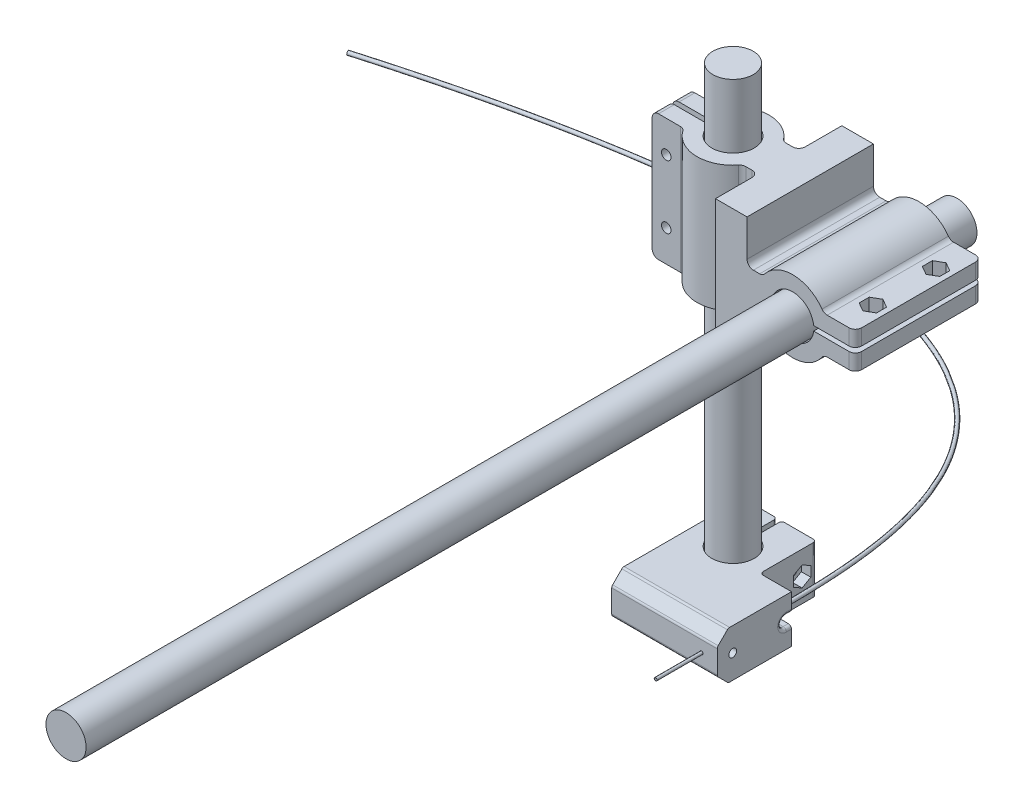
from build123d import *

# Parameters (mm, degrees)
BOSS_EXTRUDE1_DEPTH       = 40
BOSS_EXTRUDE1_DEPTH_BACK  = 100
SKETCH1_R                 = 6.4
BOSS_EXTRUDE2_DEPTH       = 20
BOSS_EXTRUDE2_DEPTH_BACK  = 20
SKETCH6_W                 = 40
SKETCH6_H                 = 40
BOSS_EXTRUDE6_DEPTH       = 10
BOSS_EXTRUDE7_DEPTH       = 20
BOSS_EXTRUDE7_DEPTH_BACK  = 20
FILLET4_R                 = 2
FILLET5_R                 = 2
CUT_EXTRUDE1_REACH        = 120.786
SKETCH9_R                 = 1.5
SKETCH37_R                = 1.25
CUT_EXTRUDE24_DEPTH       = 5
CUT_EXTRUDE2_REACH        = 114.828
SKETCH10_R                = 2.5
SKETCH38_R                = 1.25
CUT_EXTRUDE25_DEPTH       = 5
FILLET12_R                = 2
BOSS_EXTRUDE8_DEPTH       = 7.5
BOSS_EXTRUDE8_DEPTH_BACK  = 7.5
FILLET6_R                 = 1
FILLET7_R                 = 1
CUT_EXTRUDE8_REACH        = 133.251
SKETCH17_R                = 1.55
CUT_EXTRUDE9_DEPTH        = 3
SKETCH19_R                = 6.4
BOSS_EXTRUDE9_DEPTH       = 20
BOSS_EXTRUDE11_DEPTH      = 10
CUT_EXTRUDE15_DEPTH       = 23.4
SKETCH29_R                = 0.5
CUT_EXTRUDE16_DEPTH       = 23.5
SKETCH30_R                = 1.75
CUT_EXTRUDE17_DEPTH       = 8
FILLET10_R                = 1
SKETCH31_R                = 1.25
CUT_EXTRUDE18_DEPTH       = 5
CUT_EXTRUDE19_DEPTH       = 5
FILLET11_R                = 1
BOSS_EXTRUDE12_DEPTH      = 250
BOSS_EXTRUDE12_DEPTH_BACK = 32
SKETCH39_R                = 6.35
BOSS_EXTRUDE13_DEPTH      = 10
BOSS_EXTRUDE13_DEPTH_BACK = 30
SKETCH41_R                = 0.45
SKETCH41_R_2              = 0.4
SKETCH43_R                = 0.6


with BuildPart() as part:
    # Sketch1 → Boss-Extrude1 (new, two sides: drawn at the far end of the back side and taken through both)
    with BuildSketch(Plane(origin=(0, 0, 0), x_dir=(1, 0, 0), z_dir=(0, 1, 0)).offset(-BOSS_EXTRUDE1_DEPTH_BACK)):
        with Locations(Location((0, 0, 0), (0, 0, 270))):
            Circle(SKETCH1_R)
    extrude(amount=BOSS_EXTRUDE1_DEPTH + BOSS_EXTRUDE1_DEPTH_BACK)

    # Sketch19 → Boss-Extrude9 (add)
    with BuildSketch(Plane(origin=(0, -100, 0), x_dir=(-1, 0, 0), z_dir=(0, -1, 0))):
        with Locations(Location((0, 0, 0), (0, 0, 270))):
            Circle(SKETCH19_R)
    extrude(amount=BOSS_EXTRUDE9_DEPTH)


with BuildPart() as body_2:
    # Sketch2 → Boss-Extrude2 (new, two sides: drawn at the far end of the back side and taken through both)
    with BuildSketch(Plane(origin=(0, 0, 0), x_dir=(1, 0, 0), z_dir=(0, 1, 0)).offset(-BOSS_EXTRUDE2_DEPTH_BACK)):
        with BuildLine():
            Line((-9.843652777, 5.75), (-19.843652777, 5.75))
            Line((-19.843652777, 5.75), (-19.843652777, 0.75))
            Line((-19.843652777, 0.75), (-6.657890056, 0.75))
            ThreePointArc((-6.657890056, 0.75), (6.7, 0), (-6.657890056, -0.75))
            Line((-6.657890056, -0.75), (-19.843652777, -0.75))
            Line((-19.843652777, -0.75), (-19.843652777, -5.75))
            Line((-19.843652777, -5.75), (-9.843652777, -5.75))
            ThreePointArc((-9.843652777, -5.75), (-0.384164957, -11.393525235), (9.433981132, -6.4))
            Line((9.433981132, -6.4), (14.433981132, -6.4))
            Line((14.433981132, -6.4), (14.433981132, 6.4))
            Line((14.433981132, 6.4), (9.433981132, 6.4))
            ThreePointArc((9.433981132, 6.4), (-0.384164957, 11.393525235), (-9.843652777, 5.75))
        make_face()
    extrude(amount=BOSS_EXTRUDE2_DEPTH + BOSS_EXTRUDE2_DEPTH_BACK)

    # Sketch6 → Boss-Extrude6 (add)
    with BuildSketch(Plane(origin=(14.433981132, 0, 0), x_dir=(0, 0, -1), z_dir=(1, 0, 0))):
        Rectangle(SKETCH6_W, SKETCH6_H)
    extrude(amount=BOSS_EXTRUDE6_DEPTH)

    # Sketch7 → Boss-Extrude7 (add, two sides: drawn at the far end of the back side and taken through both)
    with BuildSketch(Plane(origin=(0, 0, 0), x_dir=(-1, 0, 0), z_dir=(0, 0, -1)).offset(-BOSS_EXTRUDE7_DEPTH_BACK)):
        with BuildLine():
            Line((-24.433981132, -6.4), (-29.433981132, -6.4))
            ThreePointArc((-29.433981132, -6.4), (-39.252127221, -11.393525235), (-48.711615041, -5.75))
            Line((-48.711615041, -5.75), (-58.711615041, -5.75))
            Line((-58.711615041, -5.75), (-58.711615041, -0.75))
            Line((-58.711615041, -0.75), (-45.52585232, -0.75))
            ThreePointArc((-45.52585232, -0.75), (-32.167962264, 0), (-45.52585232, 0.75))
            Line((-45.52585232, 0.75), (-58.711615041, 0.75))
            Line((-58.711615041, 0.75), (-58.711615041, 5.75))
            Line((-58.711615041, 5.75), (-48.711615041, 5.75))
            ThreePointArc((-48.711615041, 5.75), (-39.252127221, 11.393525235), (-29.433981132, 6.4))
            Line((-29.433981132, 6.4), (-24.433981132, 6.4))
            Line((-24.433981132, 6.4), (-24.433981132, -6.4))
        make_face()
    extrude(amount=BOSS_EXTRUDE7_DEPTH + BOSS_EXTRUDE7_DEPTH_BACK)

    # Fillet4
    fillet4_edges = [body_2.edges().sort_by_distance(p)[0] for p in [
        (24.433981132, 6.4, 0),
        (24.433981132, -6.4, 0),
        (14.433981132, 0, -6.4),
        (14.433981132, 0, 6.4),
    ]]
    fillet(fillet4_edges, radius=FILLET4_R)

    # Fillet5
    fillet5_edges = [body_2.edges().sort_by_distance(p)[0] for p in [
        (29.433981132, -6.4, 0),
        (29.433981132, 6.4, 0),
        (48.711615041, 5.75, 0),
        (48.711615041, -5.75, 0),
        (9.433981132, 0, 6.4),
        (9.433981132, 0, -6.4),
        (-9.843652777, 0, -5.75),
        (-9.843652777, 0, 5.75),
    ]]
    fillet(fillet5_edges, radius=FILLET5_R)

    # Cut-Extrude1: up to this face of the body (flat: up to its plane)
    cut_extrude1_end = Plane(body_2.part.faces().sort_by_distance((-15.387571992, 0, -5.75))[0])
    # Sketch9 → Cut-Extrude1 (cut, up to the picked face)
    with BuildSketch(Plane.XY.offset(5.75), mode=Mode.PRIVATE) as cut_extrude1_sk1:
        with Locations((-15.387571992, -10)):
            Circle(SKETCH9_R)
    cut_extrude1_tool1 = split(extrude(cut_extrude1_sk1.sketch, amount=-CUT_EXTRUDE1_REACH, mode=Mode.PRIVATE), bisect_by=cut_extrude1_end, keep=Keep.BOTH, mode=Mode.PRIVATE)
    # Sketch9 → Cut-Extrude1 (cut, up to the picked face)
    with BuildSketch(Plane.XY.offset(5.75), mode=Mode.PRIVATE) as cut_extrude1_sk2:
        with Locations((-15.387571992, 10)):
            Circle(SKETCH9_R)
    cut_extrude1_tool2 = split(extrude(cut_extrude1_sk2.sketch, amount=-CUT_EXTRUDE1_REACH, mode=Mode.PRIVATE), bisect_by=cut_extrude1_end, keep=Keep.BOTH, mode=Mode.PRIVATE)
    add(cut_extrude1_tool1.solids().sort_by(Axis((-15.387572, -10, 5.75), (0, 0, -1)))[0], mode=Mode.SUBTRACT)
    add(cut_extrude1_tool2.solids().sort_by(Axis((-15.387572, 10, 5.75), (0, 0, -1)))[0], mode=Mode.SUBTRACT)

    # Sketch37 → Cut-Extrude24 (cut)
    # profile 1 of 2: a face of its own
    with BuildSketch(Plane(origin=(0, 0, -5.75), x_dir=(-1, 0, 0), z_dir=(0, 0, -1))):
        Polygon((18.137571992, -8.41228676), (18.137571992, -11.58771324), (15.387571992, -13.175426481), (12.637571992, -11.58771324), (12.637571992, -8.41228676), (15.387571992, -6.824573519), align=None)
        with Locations((15.387571992, -10)):
            Circle(SKETCH37_R, mode=Mode.SUBTRACT)
    # profile 2 of 2: a face of its own
    with BuildSketch(Plane(origin=(0, 0, -5.75), x_dir=(-1, 0, 0), z_dir=(0, 0, -1))):
        Polygon((15.387571992, 13.175426481), (18.137571992, 11.58771324), (18.137571992, 8.41228676), (15.387571992, 6.824573519), (12.637571992, 8.41228676), (12.637571992, 11.58771324), align=None)
        with Locations((15.387571992, 10)):
            Circle(SKETCH37_R, mode=Mode.SUBTRACT)
    extrude(amount=-CUT_EXTRUDE24_DEPTH, mode=Mode.SUBTRACT)

    # Cut-Extrude2: up to this face of the body (flat: up to its plane)
    cut_extrude2_end = Plane(body_2.part.faces().sort_by_distance((54.255534256, 5.75, 0))[0])
    # Sketch10 → Cut-Extrude2 (cut, up to the picked face)
    with BuildSketch(Plane(origin=(0, -5.75, 0), x_dir=(-1, 0, 0), z_dir=(0, -1, 0)), mode=Mode.PRIVATE) as cut_extrude2_sk1:
        with Locations(Location((-54.255534256, 10, 0), (0, 0, 180))):
            Circle(SKETCH10_R)
    cut_extrude2_tool1 = split(extrude(cut_extrude2_sk1.sketch, amount=-CUT_EXTRUDE2_REACH, mode=Mode.PRIVATE), bisect_by=cut_extrude2_end, keep=Keep.BOTH, mode=Mode.PRIVATE)
    # Sketch10 → Cut-Extrude2 (cut, up to the picked face)
    with BuildSketch(Plane(origin=(0, -5.75, 0), x_dir=(-1, 0, 0), z_dir=(0, -1, 0)), mode=Mode.PRIVATE) as cut_extrude2_sk2:
        with Locations(Location((-54.255534256, -10, 0), (0, 0, 180))):
            Circle(SKETCH10_R)
    cut_extrude2_tool2 = split(extrude(cut_extrude2_sk2.sketch, amount=-CUT_EXTRUDE2_REACH, mode=Mode.PRIVATE), bisect_by=cut_extrude2_end, keep=Keep.BOTH, mode=Mode.PRIVATE)
    add(cut_extrude2_tool1.solids().sort_by(Axis((54.255534, -5.75, -10), (0, 1, 0)))[0], mode=Mode.SUBTRACT)
    add(cut_extrude2_tool2.solids().sort_by(Axis((54.255534, -5.75, 10), (0, 1, 0)))[0], mode=Mode.SUBTRACT)

    # Sketch38 → Cut-Extrude25 (cut)
    # profile 1 of 2: a face of its own
    with BuildSketch(Plane(origin=(0, 5.75, 0), x_dir=(1, 0, 0), z_dir=(0, 1, 0))):
        Polygon((57.005534256, 11.58771324), (57.005534256, 8.41228676), (54.255534256, 6.824573519), (51.505534256, 8.41228676), (51.505534256, 11.58771324), (54.255534256, 13.175426481), align=None)
        with Locations((54.255534256, 10)):
            Circle(SKETCH38_R, mode=Mode.SUBTRACT)
    # profile 2 of 2: a face of its own
    with BuildSketch(Plane(origin=(0, 5.75, 0), x_dir=(1, 0, 0), z_dir=(0, 1, 0))):
        Polygon((54.255534256, -6.824573519), (57.005534256, -8.41228676), (57.005534256, -11.58771324), (54.255534256, -13.175426481), (51.505534256, -11.58771324), (51.505534256, -8.41228676), align=None)
        with Locations((54.255534256, -10)):
            Circle(SKETCH38_R, mode=Mode.SUBTRACT)
    extrude(amount=-CUT_EXTRUDE25_DEPTH, mode=Mode.SUBTRACT)

    # Fillet12
    fillet12_edges = [body_2.edges().sort_by_distance(p)[0] for p in [
        (-19.843652777, -20, 3.25),
        (-19.843652777, 20, -3.25),
        (-19.843652777, 20, 3.25),
        (-19.843652777, -20, -3.25),
        (58.711615041, -3.25, 20),
        (58.711615041, 3.25, 20),
        (58.711615041, 3.25, -20),
        (58.711615041, -3.25, -20),
    ]]
    fillet(fillet12_edges, radius=FILLET12_R)


with BuildPart() as body_3:
    # Sketch13 → Boss-Extrude8 (new, two sides: drawn at the far end of the back side and taken through both)
    with BuildSketch(Plane.XZ.offset(100).offset(-BOSS_EXTRUDE8_DEPTH_BACK)):
        with BuildLine():
            Line((11.7, -14.657890056), (11.7, 26.7))
            Line((11.7, 26.7), (-11.7, 26.7))
            Line((-11.7, 26.7), (-11.7, -14.657890056))
            Line((-11.7, -14.657890056), (-0.75, -14.657890056))
            Line((-0.75, -14.657890056), (-0.75, -6.657890056))
            ThreePointArc((-0.75, -6.657890056), (0, 6.7), (0.75, -6.657890056))
            Line((0.75, -6.657890056), (0.75, -14.657890056))
            Line((0.75, -14.657890056), (11.7, -14.657890056))
        make_face()
    extrude(amount=BOSS_EXTRUDE8_DEPTH + BOSS_EXTRUDE8_DEPTH_BACK)

    # Fillet6
    fillet6_edges = [body_3.edges().sort_by_distance(p)[0] for p in [
        (-11.7, -100, -14.657890056),
        (11.7, -100, -14.657890056),
    ]]
    fillet(fillet6_edges, radius=FILLET6_R)

    # Fillet7
    fillet7_edges = [body_3.edges().sort_by_distance(p)[0] for p in [
        (0.75, -100, -14.657890056),
        (-0.75, -100, -14.657890056),
    ]]
    fillet(fillet7_edges, radius=FILLET7_R)

    # Cut-Extrude8: up to this face of the body (flat: up to its plane)
    cut_extrude8_end = Plane(body_3.part.faces().sort_by_distance((11.7, -100, 6.521054972))[0])
    # Sketch17 → Cut-Extrude8 (cut, up to the picked face)
    with BuildSketch(Plane.ZY.offset(11.7), mode=Mode.PRIVATE) as cut_extrude8_sk1:
        with Locations((-10.157890056, -100)):
            Circle(SKETCH17_R)
    cut_extrude8_tool1 = split(extrude(cut_extrude8_sk1.sketch, amount=-CUT_EXTRUDE8_REACH, mode=Mode.PRIVATE), bisect_by=cut_extrude8_end, keep=Keep.BOTH, mode=Mode.PRIVATE)
    add(cut_extrude8_tool1.solids().sort_by(Axis((-11.7, -100, -10.15789), (1, 0, 0)))[0], mode=Mode.SUBTRACT)

    # Sketch18 → Cut-Extrude9 (cut)
    with BuildSketch(Plane(origin=(11.7, 0, 0), x_dir=(0, 0, -1), z_dir=(1, 0, 0))):
        Polygon((12.907890056, -98.41228676), (12.907890056, -101.58771324), (10.157890056, -103.175426481), (7.407890056, -101.58771324), (7.407890056, -98.41228676), (10.157890056, -96.824573519), align=None)
    extrude(amount=-CUT_EXTRUDE9_DEPTH, mode=Mode.SUBTRACT)

    # Sketch27 → Boss-Extrude11 (add)
    with BuildSketch(Plane(origin=(11.7, 0, 0), x_dir=(0, 0, -1), z_dir=(1, 0, 0))):
        Polygon((-23.2, -92.5), (-26.7, -96), (-26.7, -104), (-23.2, -107.5), (-3.2, -107.5), (-3.2, -92.5), align=None)
    extrude(amount=BOSS_EXTRUDE11_DEPTH)

    # Sketch28 → Cut-Extrude15 (cut)
    with BuildSketch(Plane(origin=(11.7, 0, 0), x_dir=(0, 0, -1), z_dir=(1, 0, 0))):
        Polygon((-26.7, -92.5), (-26.7, -96), (-23.2, -92.5), align=None)
        Polygon((-26.7, -107.5), (-23.2, -107.5), (-26.7, -104), align=None)
    extrude(amount=-CUT_EXTRUDE15_DEPTH, mode=Mode.SUBTRACT)

    # Sketch29 → Cut-Extrude16 (cut)
    with BuildSketch(Plane(origin=(0, 0, 3.2), x_dir=(-1, 0, 0), z_dir=(0, 0, -1))):
        with Locations(Location((-16.7, -100, 0), (0, 0, 90))):
            Circle(SKETCH29_R)
    extrude(amount=-CUT_EXTRUDE16_DEPTH, mode=Mode.SUBTRACT)

    # Sketch30 → Cut-Extrude17 (cut)
    with BuildSketch(Plane(origin=(0, 0, 3.2), x_dir=(-1, 0, 0), z_dir=(0, 0, -1))):
        with Locations(Location((-16.7, -100, 0), (0, 0, 90))):
            Circle(SKETCH30_R)
    extrude(amount=-CUT_EXTRUDE17_DEPTH, mode=Mode.SUBTRACT)

    # Fillet10
    fillet10_edges = [body_3.edges().sort_by_distance(p)[0] for p in [
        (5, -92.5, 23.2),
        (5, -96, 26.7),
        (5, -104, 26.7),
        (5, -107.5, 23.2),
        (11.7, -100, 3.2),
    ]]
    fillet(fillet10_edges, radius=FILLET10_R)

    # Sketch31 → Cut-Extrude18 (cut)
    with BuildSketch(Plane(origin=(21.7, 0, 0), x_dir=(0, 0, -1), z_dir=(1, 0, 0))):
        with Locations((-21.796919258, -100)):
            Circle(SKETCH31_R)
    extrude(amount=-CUT_EXTRUDE18_DEPTH, mode=Mode.SUBTRACT)

    # Sketch32 → Cut-Extrude19 (cut)
    with BuildSketch(Plane(origin=(21.7, 0, 0), x_dir=(0, 0, -1), z_dir=(1, 0, 0))):
        with BuildLine():
            Line((-1.581074264, -101.75), (-4.818925736, -101.75))
            ThreePointArc((-4.818925736, -101.75), (-6.568925736, -100), (-4.818925736, -98.25))
            Line((-4.818925736, -98.25), (-1.581074264, -98.25))
            ThreePointArc((-1.581074264, -98.25), (0.168925736, -100), (-1.581074264, -101.75))
        make_face()
    extrude(amount=-CUT_EXTRUDE19_DEPTH, mode=Mode.SUBTRACT)

    # Fillet11
    fillet11_edges = [body_3.edges().sort_by_distance(p)[0] for p in [
        (21.7, -101.75, 4.009462868),
        (21.7, -98.25, 4.009462868),
        (21.7, -100, 6.568925736),
    ]]
    fillet(fillet11_edges, radius=FILLET11_R)


with BuildPart() as body_4:
    # Sketch39 → Boss-Extrude12 (new, two sides: drawn at the far end of the back side and taken through both)
    with BuildSketch(Plane.XY.offset(-BOSS_EXTRUDE12_DEPTH_BACK)):
        with Locations((38.867962264, 0)):
            Circle(SKETCH39_R)
    extrude(amount=BOSS_EXTRUDE12_DEPTH + BOSS_EXTRUDE12_DEPTH_BACK)


with BuildPart() as body_5:
    # Sketch41 → Boss-Extrude13 (new, two sides: drawn at the far end of the back side and taken through both)
    with BuildSketch(Plane(origin=(0, 0, 11.2), x_dir=(-1, 0, 0), z_dir=(0, 0, -1)).offset(-BOSS_EXTRUDE13_DEPTH_BACK)):
        with Locations(Location((-16.7, -100, 0), (0, 0, 90))):
            Circle(SKETCH41_R)
        with Locations(Location((-16.7, -100, 0), (0, 0, 90))):
            Circle(SKETCH41_R_2, mode=Mode.SUBTRACT)
    extrude(amount=BOSS_EXTRUDE13_DEPTH + BOSS_EXTRUDE13_DEPTH_BACK)

    # Sweep1: sweep along a path in Sketch42
    with BuildLine() as sweep1_path:  # in the path sketch's own coordinates; laid on its plane below (add() does not lay a ready-made edge on the line's plane)
        add(Edge.make_bspline(
            [(17.2, -11.2), (17.2, 4.47883625), (20.203029113, 78.268150519), (-56.375237774, 124.875390166), (-203.841706441, 82.315194657)],
            knots=[0, 0, 0, 0, 0.360127544, 1, 1, 1, 1], degree=3))
    # Sketch43 → Sweep1 (sweep)
    with BuildSketch(Plane(origin=(0, 0, 11.2), x_dir=(-1, 0, 0), z_dir=(0, 0, -1))):
        with Locations((-16.7, -100)):
            Circle(SKETCH43_R)
    sweep(path=Plane(origin=(0, -100, 0), x_dir=(1, 0, 0), z_dir=(0, 1, 0)) * sweep1_path.line)


solid = Compound([part.part, body_2.part, body_3.part, body_4.part, body_5.part])
